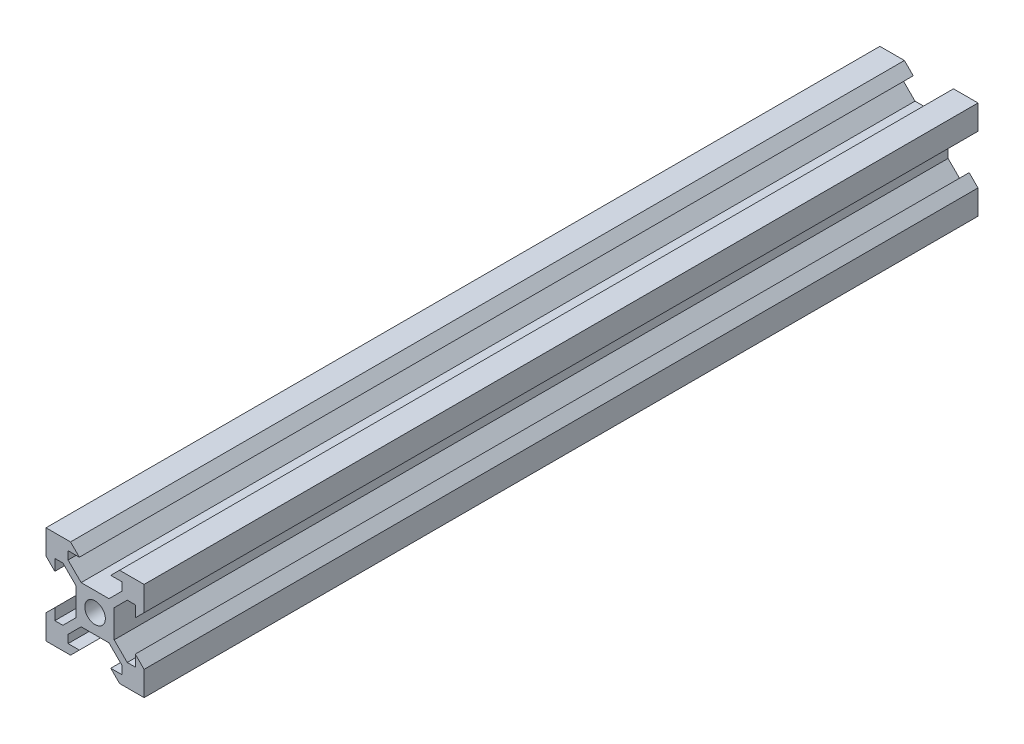
from build123d import *

# Parameters (mm, degrees)
SKETCH1_R           = 2.1
BOSS_EXTRUDE1_DEPTH = 170


with BuildPart() as part:
    # Sketch1 → Boss-Extrude1 (new body)
    with BuildSketch(Plane.XY):
        Polygon((-10, 10), (-10, 5), (-8.2, 3.2), (-8.2, 5.499339828), (-6.56, 5.499339828), (-3.900660172, 2.84), (-3.900660172, -2.84), (-6.56, -5.499339828), (-8.2, -5.499339828), (-8.2, -3.2), (-10, -5), (-10, -10), (-5, -10), (-3.2, -8.2), (-5.499339828, -8.2), (-5.499339828, -6.56), (-2.84, -3.900660172), (2.84, -3.900660172), (5.499339828, -6.56), (5.499339828, -8.2), (3.2, -8.2), (5, -10), (10, -10), (10, -5), (8.2, -3.2), (8.2, -5.499339828), (6.56, -5.499339828), (3.900660172, -2.84), (3.900660172, 2.84), (6.56, 5.499339828), (8.2, 5.499339828), (8.2, 3.2), (10, 5), (10, 10), (5, 10), (3.2, 8.2), (5.499339828, 8.2), (5.499339828, 6.56), (2.84, 3.900660172), (-2.84, 3.900660172), (-5.499339828, 6.56), (-5.499339828, 8.2), (-3.2, 8.2), (-5, 10), align=None)
        Circle(SKETCH1_R, mode=Mode.SUBTRACT)
    extrude(amount=-BOSS_EXTRUDE1_DEPTH)


solid = part.part
